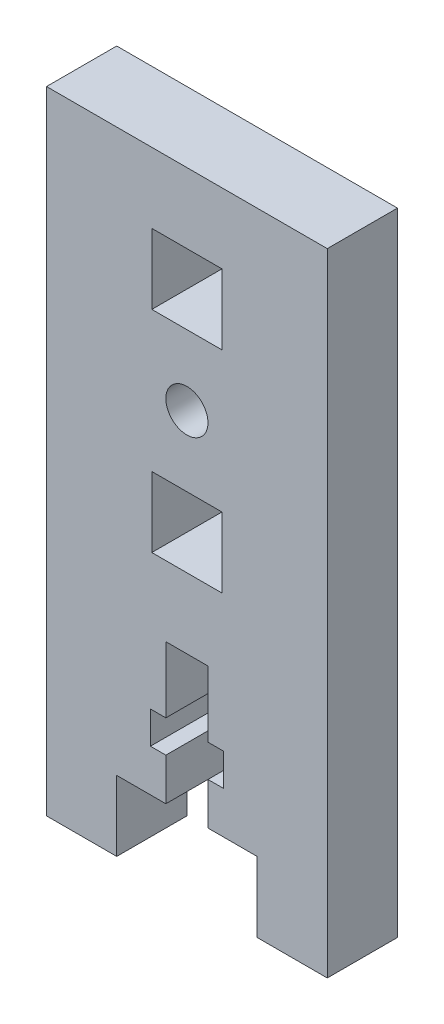
from build123d import *

# Parameters (mm, degrees)
SKETCH1_R           = 1.5
SKETCH1_W           = 5
SKETCH1_H           = 5
BOSS_EXTRUDE1_DEPTH = 5


with BuildPart() as part:
    # Sketch1 → Boss-Extrude1 (new body)
    with BuildSketch(Plane.XY):
        Polygon((0, 0), (0, 40), (20, 40), (20, 0), (20, -5), (15, -5), (15, 0), (11.5, 0), (11.5, 3), (12.6, 3), (12.6, 5.3), (11.5, 5.3), (11.5, 10), (8.5, 10), (8.5, 5.3), (7.4, 5.3), (7.4, 3), (8.5, 3), (8.5, 0), (5, 0), (5, -5), (0, -5), align=None)
        with Locations((10, 25)):
            Circle(SKETCH1_R, mode=Mode.SUBTRACT)
        with Locations((10, 17.5)):
            Rectangle(SKETCH1_W, SKETCH1_H, mode=Mode.SUBTRACT)
        with Locations((10, 32.5)):
            Rectangle(SKETCH1_W, SKETCH1_H, mode=Mode.SUBTRACT)
    extrude(amount=BOSS_EXTRUDE1_DEPTH)


solid = part.part
